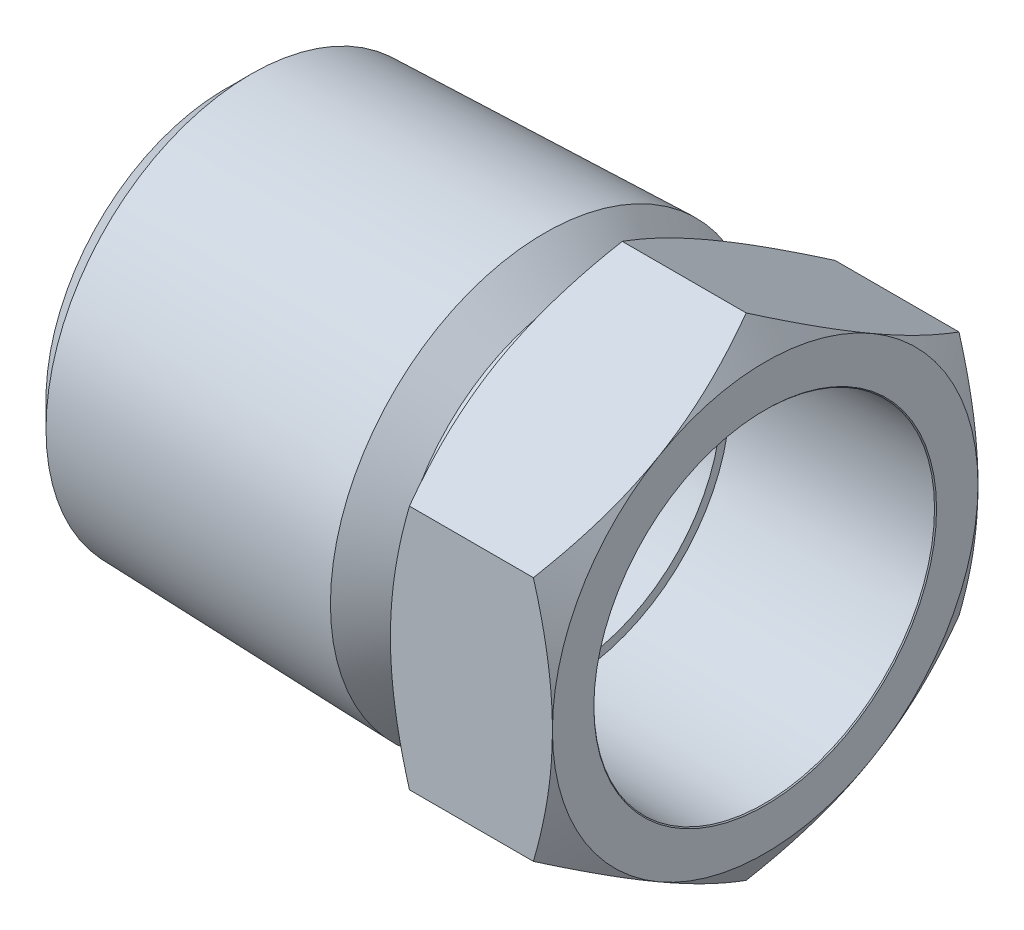
from build123d import *

# Parameters (mm, degrees)
SKETCH2_R          = 10.668
EXTRUDE1_DEPTH     = 28.194
EXTRUDE1_DRAFT     = -1.783333333
SKETCH5_OUTSIDE_W  = 100.882
SKETCH5_OUTSIDE_H  = 100.882
SKETCH5_OUTSIDE_R  = 9.362586861
CUT_EXTRUDE1_DEPTH = 33.580879133
CUT_EXTRUDE1_DRAFT = 45
SKETCH8_R          = 17.018
CUT_EXTRUDE4_DEPTH = 26.614719415
SKETCH9_OUTSIDE_W  = 32.068
SKETCH9_OUTSIDE_H  = 32.068
SKETCH9_OUTSIDE_R  = 9.489586861
CUT_EXTRUDE5_DEPTH = 1.360714286
SKETCH10_OUTSIDE_W = 82.558
SKETCH10_OUTSIDE_H = 82.558
SKETCH10_OUTSIDE_R = 9.489586861
CUT_EXTRUDE6_DEPTH = 25.296582495
CUT_EXTRUDE6_DRAFT = -45
EXTRUDE2_DEPTH     = 8.4582
SKETCH7_OUTSIDE_W  = 150.768
SKETCH7_OUTSIDE_H  = 154.058
SKETCH7_OUTSIDE_R  = 11.1125
CUT_EXTRUDE2_DEPTH = 33.934882333
CUT_EXTRUDE2_DRAFT = -60
SKETCH18_OUTSIDE_W = 67.856
SKETCH18_OUTSIDE_H = 71.146
SKETCH18_OUTSIDE_R = 11.1125
EXTRUDE3_DEPTH     = 10
EXTRUDE3_DRAFT     = -60
SKETCH11_R         = 8.5725
CUT_EXTRUDE7_DEPTH = 25.615711208
CUT_EXTRUDE7_DRAFT = -1.783333333
SKETCH16_R         = 8.947540861
CUT_EXTRUDE9_DEPTH = 6.35
CUT_EXTRUDE9_DRAFT = -45
SKETCH17_W         = 17.78
SKETCH17_H         = 8.114228224


with BuildPart() as part:
    # Sketch2 → Extrude1 (with draft: the straight prism first)
    with BuildSketch(Plane(origin=(-14.097, 0, 0), x_dir=(0, 0, -1), z_dir=(1, 0, 0))):
        Circle(SKETCH2_R)
    extrude(amount=EXTRUDE1_DEPTH)
    # Extrude1: the draft: its side faces are tilted about the plane it starts from
    extrude1_sides = [part.faces().sort_by_distance(p)[0] for p in [
        (0, 0, 10.668),
    ]]
    draft(extrude1_sides, Plane(origin=(-14.097, 0, 0), x_dir=(0, 0, -1), z_dir=(1, 0, 0)), EXTRUDE1_DRAFT)


with BuildPart() as cut_extrude1_tool:
    # Sketch5 outside → Cut-Extrude1 (with draft: the straight prism first)
    with BuildSketch(Plane(origin=(-14.097, 0, 0), x_dir=(0, 0, -1), z_dir=(1, 0, 0))):
        Rectangle(SKETCH5_OUTSIDE_W, SKETCH5_OUTSIDE_H)
        Circle(SKETCH5_OUTSIDE_R, mode=Mode.SUBTRACT)
    extrude(amount=CUT_EXTRUDE1_DEPTH)
    # Cut-Extrude1: the draft: its side faces are tilted about the plane it starts from
    cut_extrude1_sides = [cut_extrude1_tool.faces().sort_by_distance(p)[0] for p in [
        (2.693439567, -50.441, 0),
        (2.693439567, 0, -50.441),
        (2.693439567, 50.441, 0),
        (2.693439567, 0, 50.441),
        (2.693439567, 0, 9.362586861),
    ]]
    draft(cut_extrude1_sides, Plane(origin=(-14.097, 0, 0), x_dir=(0, 0, -1), z_dir=(1, 0, 0)), CUT_EXTRUDE1_DRAFT)


with BuildPart() as part_1:
    add(part.part)

    # Cut-Extrude1: cut by cut_extrude1_tool
    add(cut_extrude1_tool.part, mode=Mode.SUBTRACT)

    # Sketch8 → Cut-Extrude4 (cut, through all)
    with BuildSketch(Plane(origin=(5.6388, 0, 0), x_dir=(0, 0, -1), z_dir=(1, 0, 0))):
        Circle(SKETCH8_R)
    extrude(amount=CUT_EXTRUDE4_DEPTH, mode=Mode.SUBTRACT)

    # Sketch9 outside → Cut-Extrude5 (cut)
    with BuildSketch(Plane(origin=(5.6388, 0, 0), x_dir=(0, 0, -1), z_dir=(1, 0, 0))):
        Rectangle(SKETCH9_OUTSIDE_W, SKETCH9_OUTSIDE_H)
        Circle(SKETCH9_OUTSIDE_R, mode=Mode.SUBTRACT)
    extrude(amount=-CUT_EXTRUDE5_DEPTH, mode=Mode.SUBTRACT)


with BuildPart() as cut_extrude6_tool:
    # Sketch10 outside → Cut-Extrude6 (with draft: the straight prism first)
    with BuildSketch(Plane(origin=(4.278085714, 0, 0), x_dir=(0, 0, -1), z_dir=(1, 0, 0))):
        Rectangle(SKETCH10_OUTSIDE_W, SKETCH10_OUTSIDE_H)
        Circle(SKETCH10_OUTSIDE_R, mode=Mode.SUBTRACT)
    extrude(amount=-CUT_EXTRUDE6_DEPTH)
    # Cut-Extrude6: the draft: its side faces are tilted about the plane it starts from
    cut_extrude6_sides = [cut_extrude6_tool.faces().sort_by_distance(p)[0] for p in [
        (-8.370205533, -41.279, 0),
        (-8.370205533, 0, -41.279),
        (-8.370205533, 41.279, 0),
        (-8.370205533, 0, 41.279),
        (-8.370205533, 0, 9.489586861),
    ]]
    draft(cut_extrude6_sides, Plane(origin=(4.278085714, 0, 0), x_dir=(0, 0, -1), z_dir=(1, 0, 0)), CUT_EXTRUDE6_DRAFT)


with BuildPart() as part_2:
    add(part_1.part)

    # Cut-Extrude6: cut by cut_extrude6_tool
    add(cut_extrude6_tool.part, mode=Mode.SUBTRACT)

    # Sketch6 → Extrude2 (add)
    with BuildSketch(Plane(origin=(14.097, 0, 0), x_dir=(0, 0, -1), z_dir=(1, 0, 0))):
        Polygon((0, 12.831609733), (-11.1125, 6.415804866), (-11.1125, -6.415804866), (0, -12.831609733), (11.1125, -6.415804866), (11.1125, 6.415804866), align=None)
    extrude(amount=-EXTRUDE2_DEPTH)


with BuildPart() as cut_extrude2_tool:
    # Sketch7 outside → Cut-Extrude2 (with draft: the straight prism first)
    with BuildSketch(Plane(origin=(14.097, 0, 0), x_dir=(0, 0, -1), z_dir=(1, 0, 0))):
        Rectangle(SKETCH7_OUTSIDE_W, SKETCH7_OUTSIDE_H)
        Circle(SKETCH7_OUTSIDE_R, mode=Mode.SUBTRACT)
    extrude(amount=-CUT_EXTRUDE2_DEPTH)
    # Cut-Extrude2: the draft: its side faces are tilted about the plane it starts from
    cut_extrude2_sides = [cut_extrude2_tool.faces().sort_by_distance(p)[0] for p in [
        (-2.870441167, -77.029, 0),
        (-2.870441167, 0, -75.384),
        (-2.870441167, 77.029, 0),
        (-2.870441167, 0, 75.384),
        (-2.870441167, 0, 11.1125),
    ]]
    draft(cut_extrude2_sides, Plane(origin=(14.097, 0, 0), x_dir=(0, 0, -1), z_dir=(1, 0, 0)), CUT_EXTRUDE2_DRAFT)


with BuildPart() as part_3:
    add(part_2.part)

    # Cut-Extrude2: cut by cut_extrude2_tool
    add(cut_extrude2_tool.part, mode=Mode.SUBTRACT)


with BuildPart() as extrude3_tool:
    # Sketch18 outside → Extrude3 (with draft: the straight prism first)
    with BuildSketch(Plane.ZY.offset(-5.6388)):
        Rectangle(SKETCH18_OUTSIDE_W, SKETCH18_OUTSIDE_H)
        Circle(SKETCH18_OUTSIDE_R, mode=Mode.SUBTRACT)
    extrude(amount=-EXTRUDE3_DEPTH)
    # Extrude3: the draft: its side faces are tilted about the plane it starts from
    extrude3_sides = [extrude3_tool.faces().sort_by_distance(p)[0] for p in [
        (10.6388, -35.573, 0),
        (10.6388, 0, 33.928),
        (10.6388, 35.573, 0),
        (10.6388, 0, -33.928),
        (10.6388, 0, -11.1125),
    ]]
    draft(extrude3_sides, Plane.ZY.offset(-5.6388), EXTRUDE3_DRAFT)


with BuildPart() as part_4:
    add(part_3.part)

    # Extrude3: cut by extrude3_tool
    add(extrude3_tool.part, mode=Mode.SUBTRACT)


with BuildPart() as cut_extrude7_tool:
    # Sketch11 → Cut-Extrude7 (with draft: the straight prism first)
    with BuildSketch(Plane(origin=(3.683, 0, 0), x_dir=(0, 0, -1), z_dir=(1, 0, 0))):
        Circle(SKETCH11_R)
    extrude(amount=CUT_EXTRUDE7_DEPTH)
    # Cut-Extrude7: the draft: its side faces are tilted about the plane it starts from
    cut_extrude7_sides = [cut_extrude7_tool.faces().sort_by_distance(p)[0] for p in [
        (16.490855604, 0, 8.5725),
    ]]
    draft(cut_extrude7_sides, Plane(origin=(3.683, 0, 0), x_dir=(0, 0, -1), z_dir=(1, 0, 0)), CUT_EXTRUDE7_DRAFT)


with BuildPart() as part_5:
    add(part_4.part)

    # Cut-Extrude7: cut by cut_extrude7_tool
    add(cut_extrude7_tool.part, mode=Mode.SUBTRACT)


with BuildPart() as cut_extrude9_tool:
    # Sketch16 → Cut-Extrude9 (with draft: the straight prism first)
    with BuildSketch(Plane(origin=(14.097, 0, 0), x_dir=(0, 0, -1), z_dir=(1, 0, 0))):
        Circle(SKETCH16_R)
    extrude(amount=-CUT_EXTRUDE9_DEPTH)
    # Cut-Extrude9: the draft: its side faces are tilted about the plane it starts from
    cut_extrude9_sides = [cut_extrude9_tool.faces().sort_by_distance(p)[0] for p in [
        (10.922, 0, 8.947540861),
    ]]
    draft(cut_extrude9_sides, Plane(origin=(14.097, 0, 0), x_dir=(0, 0, -1), z_dir=(1, 0, 0)), CUT_EXTRUDE9_DRAFT)


with BuildPart() as part_6:
    add(part_5.part)

    # Cut-Extrude9: cut by cut_extrude9_tool
    add(cut_extrude9_tool.part, mode=Mode.SUBTRACT)

    # Sketch17 → Cut-Revolve1 (revolve, cut)
    with BuildSketch(Plane.XY, mode=Mode.PRIVATE) as cut_revolve1_sk:
        with Locations((-5.207, 4.057114112)):
            Rectangle(SKETCH17_W, SKETCH17_H)
    revolve(cut_revolve1_sk.sketch.rotate(Axis((-14.097, 0, 0), (1, 0, 0)), 90), axis=Axis((-14.097, 0, 0), (1, 0, 0)), mode=Mode.SUBTRACT)


solid = part_6.part
